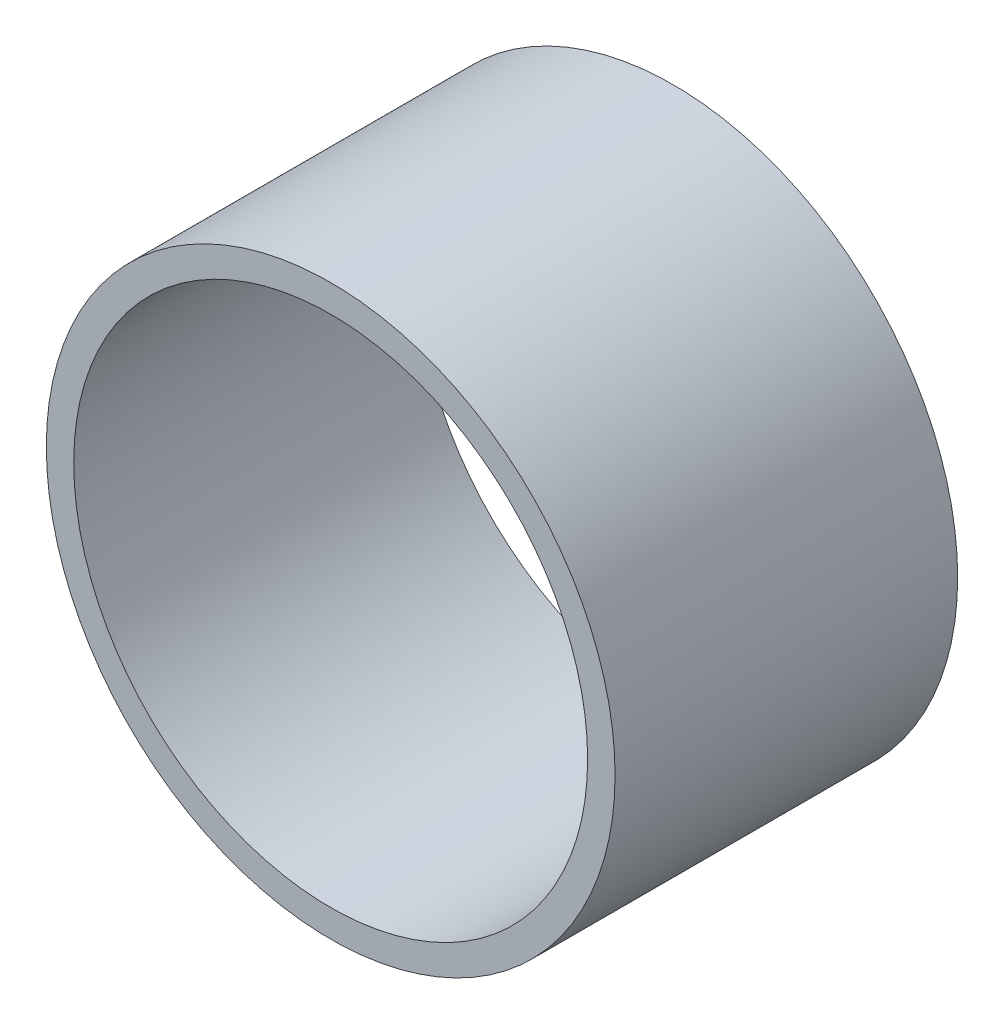
from build123d import *

# Parameters (mm, degrees)
SKETCH1_R           = 0.415
SKETCH1_R_2         = 0.375
BOSS_EXTRUDE1_DEPTH = 0.5


with BuildPart() as part:
    # Sketch1 → Boss-Extrude1 (new body)
    with BuildSketch(Plane.XY):
        Circle(SKETCH1_R)
        Circle(SKETCH1_R_2, mode=Mode.SUBTRACT)
    extrude(amount=BOSS_EXTRUDE1_DEPTH)


solid = part.part
